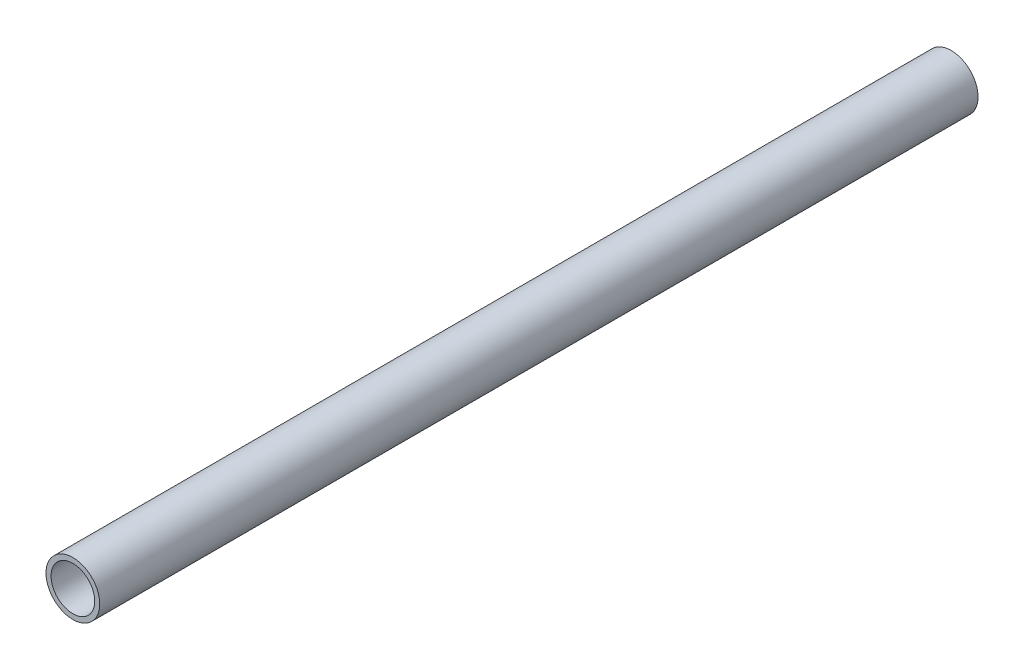
from build123d import *

# Parameters (mm, degrees)
CROQUIS1_R     = 16
EXTRUIR1_DEPTH = 259
VACIADO1_T     = -3
CROQUIS2_R     = 16
EXTRUIR2_DEPTH = 5


with BuildPart() as part:
    # Croquis1 → Extruir1 (new, symmetric)
    with BuildSketch(Plane.XY):
        Circle(CROQUIS1_R)
    extrude(amount=EXTRUIR1_DEPTH, both=True)

    # Vaciado1
    vaciado1_openings = [part.faces().sort_by_distance(p)[0] for p in [
        (0, 0, 259),
        (0, 0, -259),
    ]]
    offset(amount=VACIADO1_T, openings=vaciado1_openings, kind=Kind.INTERSECTION)

    # Croquis2 → Extruir2 (add)
    with BuildSketch(Plane(origin=(0, 0, -259), x_dir=(-1, 0, 0), z_dir=(0, 0, -1))):
        Circle(CROQUIS2_R)
    extrude(amount=EXTRUIR2_DEPTH)


solid = part.part
